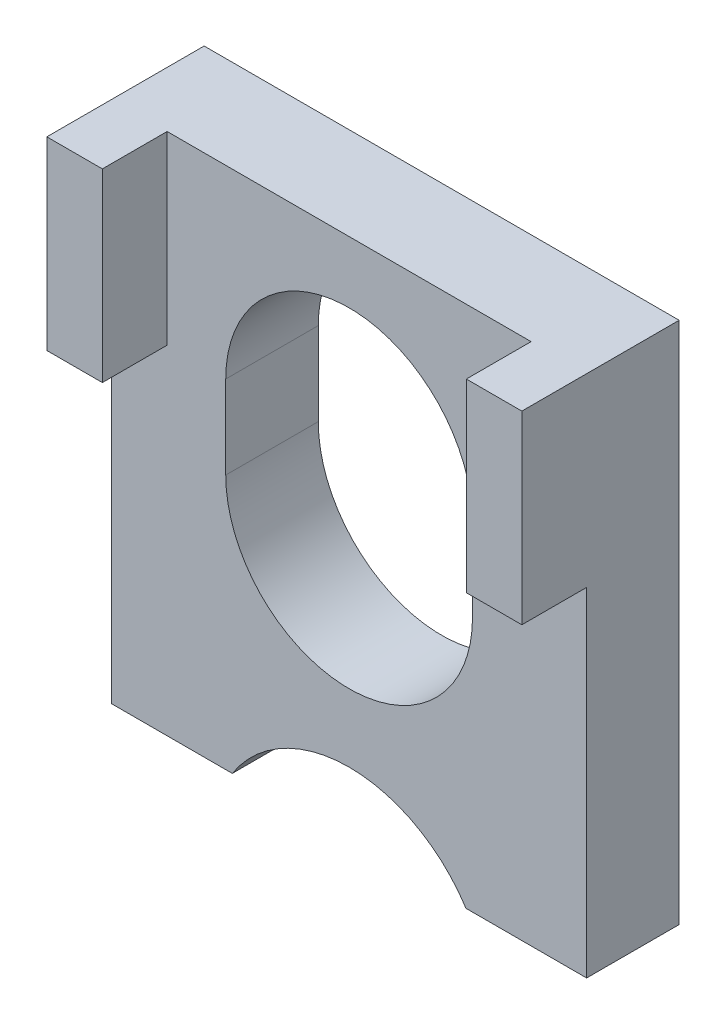
from build123d import *

# Parameters (mm, degrees)
EXTRUDE_1_DEPTH = 3
SKETCH_2_W      = 1.8
SKETCH_2_H      = 6
EXTRUDE_2_DEPTH = 2.1


with BuildPart() as part:
    # Эскиз1 → Бобышка-Вытянуть1 (new body)
    with BuildSketch(Plane.XY):
        with BuildLine():
            Line((-7.7, 13.737499607), (7.7, 13.737499607))
            Line((7.7, 13.737499607), (7.7, -0.039604792))
            Line((7.7, -0.039604792), (7.7, -3.229735589))
            Line((7.7, -3.229735589), (3.787979634, -3.229735589))
            ThreePointArc((3.787979634, -3.229735589), (0, -1.158976271), (-3.787979634, -3.229735589))
            Line((-3.787979634, -3.229735589), (-7.7, -3.229735589))
            Line((-7.7, -3.229735589), (-7.7, -0.039604792))
            Line((-7.7, -0.039604792), (-7.7, 13.737499607))
        make_face()
        with BuildLine():
            Line((4, 7.737499607), (4, 5.041023729))
            ThreePointArc((4, 5.041023729), (0, 1.041023729), (-4, 5.041023729))
            Line((-4, 5.041023729), (-4, 7.737499607))
            ThreePointArc((-4, 7.737499607), (0, 11.737499607), (4, 7.737499607))
        make_face(mode=Mode.SUBTRACT)
    extrude(amount=EXTRUDE_1_DEPTH)

    # Эскиз2 → Бобышка-Вытянуть2 (add)
    with BuildSketch(Plane.XY.offset(3)):
        with Locations((-6.8, 10.737499607)):
            Rectangle(SKETCH_2_W, SKETCH_2_H)
        with Locations((6.8, 10.737499607)):
            Rectangle(SKETCH_2_W, SKETCH_2_H)
    extrude(amount=EXTRUDE_2_DEPTH)


solid = part.part
